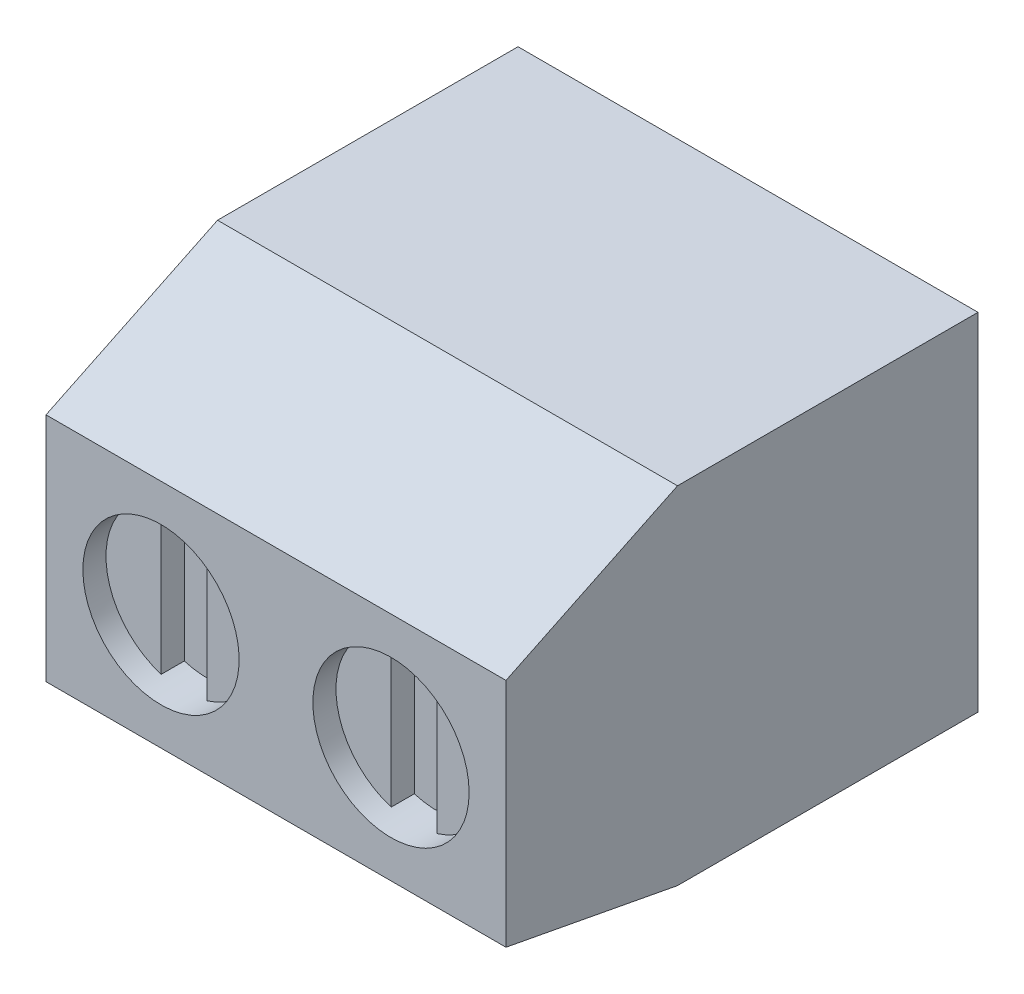
from build123d import *

# Parameters (mm, degrees)
CROQUIS1_W              = 9.95
CROQUIS1_H              = 7.49
SALIENTE_EXTRUIR1_DEPTH = 10.21
CORTAR_EXTRUIR1_DEPTH   = 17.104244782
CROQUIS3_W              = 3.98
CROQUIS3_H              = 5.08
CORTAR_EXTRUIR3_DEPTH   = 1
CROQUIS4_R              = 1.69
CORTAR_EXTRUIR4_DEPTH   = 0.5
CORTAR_EXTRUIR6_DEPTH   = 0.5
CROQUIS7_W              = 3.119915204
CROQUIS7_H              = 2.530639344
CORTAR_EXTRUIR7_DEPTH   = 2


with BuildPart() as part:
    # Croquis1 → Saliente-Extruir1 (new body)
    with BuildSketch(Plane.XY):
        with Locations((-4.975, 3.745)):
            Rectangle(CROQUIS1_W, CROQUIS1_H)
    extrude(amount=SALIENTE_EXTRUIR1_DEPTH)

    # Croquis2 → Cortar-Extruir1 (cut, through all)
    with BuildSketch(Plane.ZY.offset(9.95)):
        Polygon((10.21, 5.699503954), (10.21, 7.49), (6.5, 7.49), align=None)
        Polygon((10.21, 0.7), (10.21, 0), (6.5, 0), align=None)
    extrude(amount=-CORTAR_EXTRUIR1_DEPTH, mode=Mode.SUBTRACT)

    # Croquis3 → Cortar-Extruir3 (cut)
    with BuildSketch(Plane(origin=(0, 0, 0), x_dir=(-1, 0, 0), z_dir=(0, -1, 0))):
        with Locations((2.485, -3.54)):
            Rectangle(CROQUIS3_W, CROQUIS3_H)
        with Locations((7.465, -3.54)):
            Rectangle(CROQUIS3_W, CROQUIS3_H)
    extrude(amount=-CORTAR_EXTRUIR3_DEPTH, mode=Mode.SUBTRACT)

    # Croquis4 → Cortar-Extruir4 (cut)
    with BuildSketch(Plane.XY.offset(10.21)):
        with Locations((-2.4875, 3.199751977)):
            Circle(CROQUIS4_R)
        with Locations(Location((-7.4625, 3.199751977, 0), (0, 0, 180))):
            Circle(CROQUIS4_R)
    extrude(amount=-CORTAR_EXTRUIR4_DEPTH, mode=Mode.SUBTRACT)

    # Croquis6 → Cortar-Extruir6 (cut)
    with BuildSketch(Plane.XY.offset(9.71)):
        with BuildLine():
            Line((-6.96704565, 1.584009118), (-6.96704565, 4.815494836))
            ThreePointArc((-6.96704565, 4.815494836), (-7.4625, 4.889751977), (-7.95795435, 4.815494836))
            Line((-7.95795435, 4.815494836), (-7.95795435, 1.584009118))
            ThreePointArc((-7.95795435, 1.584009118), (-7.4625, 1.509751977), (-6.96704565, 1.584009118))
        make_face()
        with BuildLine():
            Line((-1.99204565, 1.584009118), (-1.99204565, 4.815494836))
            ThreePointArc((-1.99204565, 4.815494836), (-2.4875, 4.889751977), (-2.98295435, 4.815494836))
            Line((-2.98295435, 4.815494836), (-2.98295435, 1.584009118))
            ThreePointArc((-2.98295435, 1.584009118), (-2.4875, 1.509751977), (-1.99204565, 1.584009118))
        make_face()
    extrude(amount=-CORTAR_EXTRUIR6_DEPTH, mode=Mode.SUBTRACT)

    # Croquis7 → Cortar-Extruir7 (cut)
    with BuildSketch(Plane(origin=(0, 1, 0), x_dir=(-1, 0, 0), z_dir=(0, -1, 0))):
        with Locations((7.465, -3.54)):
            Rectangle(CROQUIS7_W, CROQUIS7_H)
        with Locations((2.485, -3.54)):
            Rectangle(CROQUIS7_W, CROQUIS7_H)
    extrude(amount=-CORTAR_EXTRUIR7_DEPTH, mode=Mode.SUBTRACT)


solid = part.part
